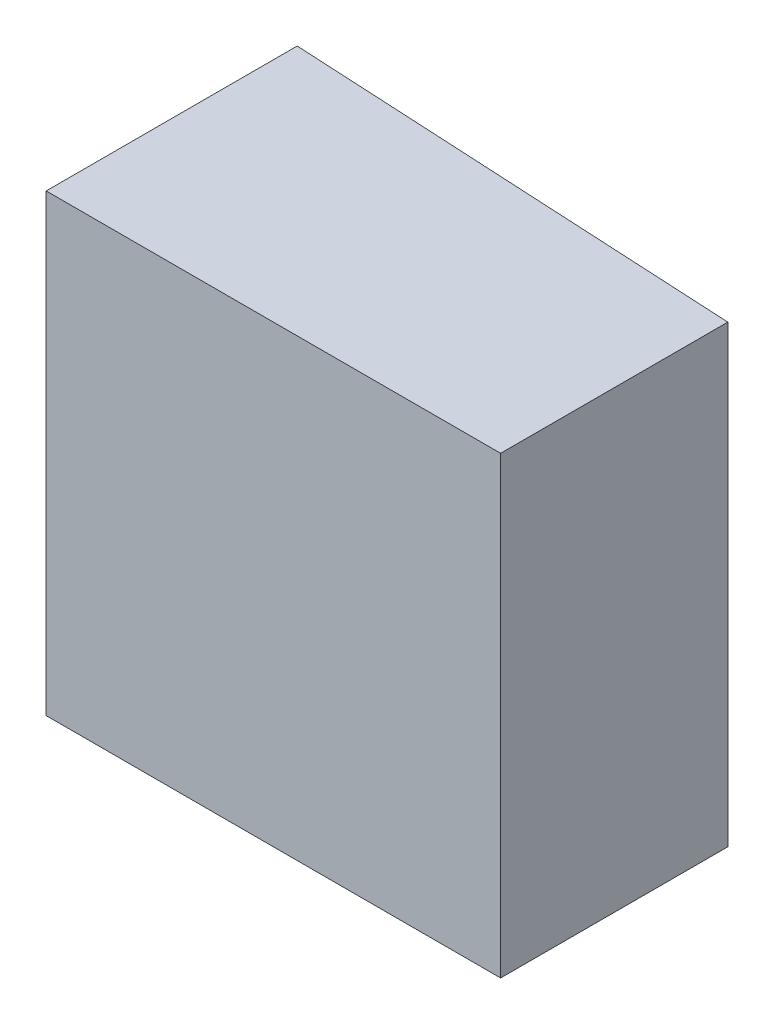
from build123d import *

# Parameters (mm, degrees)
SKETCH_1_W      = 20
SKETCH_1_H      = 20
BASEBOX_DEPTH   = 10
DRAFT3DEG_ANGLE = 3


with BuildPart() as part:
    # 草图1 → BaseBox (new body)
    with BuildSketch(Plane.XY):
        with Locations((10, 10)):
            Rectangle(SKETCH_1_W, SKETCH_1_H)
    extrude(amount=BASEBOX_DEPTH)

    # Draft3deg
    draft3deg_faces = [part.faces().sort_by_distance(p)[0] for p in [
        (10, 10, 0),
    ]]
    draft(draft3deg_faces, Plane(origin=(20, 0, 10), x_dir=(0, 0, 1), z_dir=(1, 0, 0)), DRAFT3DEG_ANGLE)


solid = part.part
